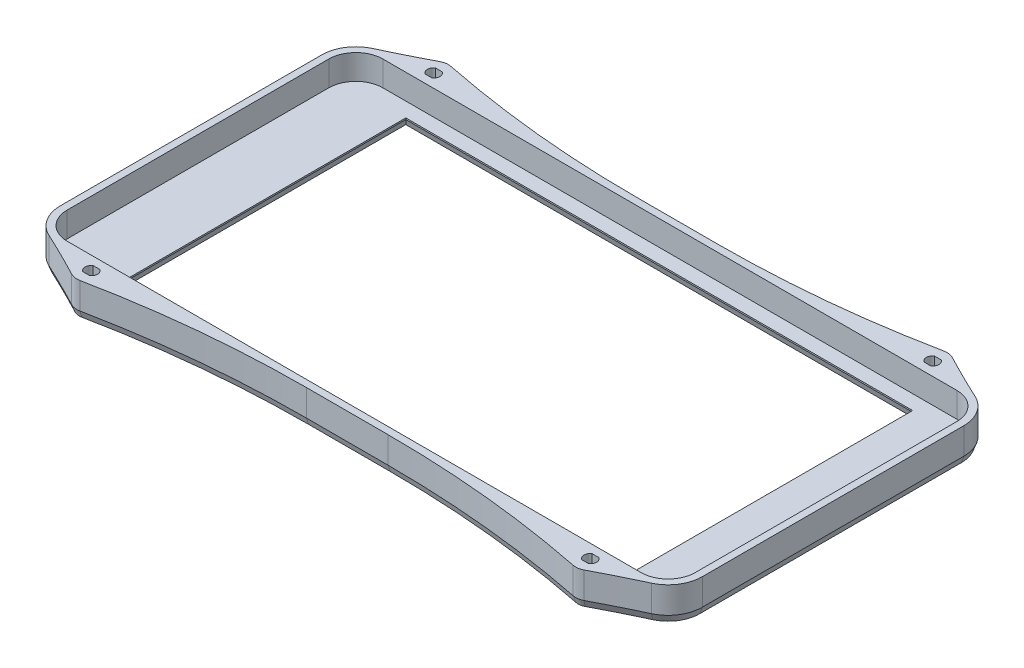
from build123d import *

# Parameters (mm, degrees)
EXTRUDE_1_DEPTH       = 2
EXTRUDE_2_DEPTH       = 8
SKETCH_6_R            = 3.5
SKETCH_6_R_2          = 1.5
EXTRUDE_10_DEPTH      = 8
SKETCH_7_W            = 121.7
SKETCH_7_H            = 68.8
CUT_EXTRUDE_1_DEPTH   = 10
FILLET_1_R            = 250
SKETCH_6_2_R          = 1.5
EXTRUDE_11_DEPTH      = 1.5
CHAMFER_1_SIZE        = 0.6
CHAMFER_1_SIZE2       = 1.648486452
CUT_EXTRUDE_START     = -6
CUT_EXTRUDE_1_2_DEPTH = 6
SKETCH_12_W           = 7.981613131
SKETCH_12_H           = 4.067552846
SKETCH_12_W_2         = 5
SKETCH_12_H_2         = 2.5
SKETCH_12_W_3         = 6.44213445
SKETCH_12_H_3         = 4.018836203
SKETCH_12_W_4         = 6.293487169
SKETCH_12_H_4         = 3.99394378
SKETCH_12_W_5         = 6.35997617
EXTRUDE_12_DEPTH      = 6.5


with BuildPart() as part:
    # 草图1 → 凸台-拉伸1 (new body)
    with BuildSketch(Plane(origin=(0, 0, 0), x_dir=(1, 0, 0), z_dir=(0, 1, 0))):
        with BuildLine():
            Line((6, 0.2), (143.8, 0.2))
            ThreePointArc((143.8, 0.2), (148.184062043, -1.615937957), (150, -6))
            Line((150, -6), (150, -68.8))
            ThreePointArc((150, -68.8), (148.184062043, -73.184062043), (143.8, -75))
            Line((143.8, -75), (6, -75))
            ThreePointArc((6, -75), (1.615937957, -73.184062043), (-0.2, -68.8))
            Line((-0.2, -68.8), (-0.2, -6))
            ThreePointArc((-0.2, -6), (1.615937957, -1.615937957), (6, 0.2))
        make_face()
    extrude(amount=EXTRUDE_1_DEPTH)

    # 草图1<5> → 拉伸-薄壁2 (add)
    with BuildSketch(Plane(origin=(0, 0, 0), x_dir=(1, 0, 0), z_dir=(0, 1, 0))):
        with BuildLine():
            Line((6, 2.2), (143.8, 2.2))
            ThreePointArc((143.8, 2.2), (149.598275606, -0.201724394), (152, -6))
            Line((152, -6), (152, -68.8))
            ThreePointArc((152, -68.8), (149.598275606, -74.598275606), (143.8, -77))
            Line((143.8, -77), (6, -77))
            ThreePointArc((6, -77), (0.201724394, -74.598275606), (-2.2, -68.8))
            Line((-2.2, -68.8), (-2.2, -6))
            ThreePointArc((-2.2, -6), (0.201724394, -0.201724394), (6, 2.2))
        make_face()
        with BuildLine():
            Line((6, 0.2), (143.8, 0.2))
            ThreePointArc((143.8, 0.2), (148.184062043, -1.615937957), (150, -6))
            Line((150, -6), (150, -68.8))
            ThreePointArc((150, -68.8), (148.184062043, -73.184062043), (143.8, -75))
            Line((143.8, -75), (6, -75))
            ThreePointArc((6, -75), (1.615937957, -73.184062043), (-0.2, -68.8))
            Line((-0.2, -68.8), (-0.2, -6))
            ThreePointArc((-0.2, -6), (1.615937957, -1.615937957), (6, 0.2))
        make_face(mode=Mode.SUBTRACT)
    extrude(amount=EXTRUDE_2_DEPTH)

    # 草图6 → 凸台-拉伸10 (add)
    # profile 1 of 4: a face of its own
    with BuildSketch(Plane(origin=(0, 0, 0), x_dir=(1, 0, 0), z_dir=(0, 1, 0))):
        with Locations((15, 3.7)):
            Circle(SKETCH_6_R)
        with Locations(Location((15, 3.7, 0), (0, 0, 90))):
            Circle(SKETCH_6_R_2, mode=Mode.SUBTRACT)
    # profile 2 of 4: a face of its own
    with BuildSketch(Plane(origin=(0, 0, 0), x_dir=(1, 0, 0), z_dir=(0, 1, 0))):
        with Locations((15, -78.5)):
            Circle(SKETCH_6_R)
        with Locations(Location((15, -78.5, 0), (0, 0, 90))):
            Circle(SKETCH_6_R_2, mode=Mode.SUBTRACT)
    # profile 3 of 4: a face of its own
    with BuildSketch(Plane(origin=(0, 0, 0), x_dir=(1, 0, 0), z_dir=(0, 1, 0))):
        with Locations((134.8, 3.7)):
            Circle(SKETCH_6_R)
        with Locations(Location((134.8, 3.7, 0), (0, 0, 90))):
            Circle(SKETCH_6_R_2, mode=Mode.SUBTRACT)
    # profile 4 of 4: a face of its own
    with BuildSketch(Plane(origin=(0, 0, 0), x_dir=(1, 0, 0), z_dir=(0, 1, 0))):
        with Locations((134.8, -78.5)):
            Circle(SKETCH_6_R)
        with Locations(Location((134.8, -78.5, 0), (0, 0, 90))):
            Circle(SKETCH_6_R_2, mode=Mode.SUBTRACT)
    extrude(amount=EXTRUDE_10_DEPTH)

    # 草图7 → Cut-Extrude 1 (cut)
    with BuildSketch(Plane(origin=(0, 0, 0), x_dir=(-1, 0, 0), z_dir=(0, -1, 0))):
        with Locations((-75.85, -37.4)):
            Rectangle(SKETCH_7_W, SKETCH_7_H)
    extrude(amount=-CUT_EXTRUDE_1_DEPTH, mode=Mode.SUBTRACT)

    # 圆角1
    fillet_1_edges = [part.edges().sort_by_distance(p)[0] for p in [
        (18.16227766, 4, 77),
        (11.83772234, 4, 77),
        (137.96227766, 4, 77),
        (131.63772234, 4, 77),
        (131.63772234, 4, -2.2),
        (137.96227766, 4, -2.2),
        (11.83772234, 4, -2.2),
        (18.16227766, 4, -2.2),
    ]]
    fillet(fillet_1_edges, radius=FILLET_1_R)

    # 草图6<2> → 凸台-拉伸11 (add)
    with BuildSketch(Plane(origin=(0, 0, 0), x_dir=(1, 0, 0), z_dir=(0, 1, 0))):
        with Locations(Location((15, 3.7, 0), (0, 0, 90))):
            Circle(SKETCH_6_2_R)
        with Locations(Location((15, -78.5, 0), (0, 0, 90))):
            Circle(SKETCH_6_2_R)
        with Locations(Location((134.8, 3.7, 0), (0, 0, 90))):
            Circle(SKETCH_6_2_R)
        with Locations(Location((134.8, -78.5, 0), (0, 0, 90))):
            Circle(SKETCH_6_2_R)
    extrude(amount=EXTRUDE_11_DEPTH)

    # 倒角1
    chamfer_1_edges = [part.edges().sort_by_distance(p)[0] for p in [
        (136.7, 0, 37.4),
        (75.85, 0, 71.8),
        (15, 0, 37.4),
        (75.85, 0, 3),
        (14.502874151, 0, 81.964515246),
        (74.9, 0, 77),
        (135.297125849, 0, 81.964515246),
        (150.714252509, 0, 73.20830038),
        (135.297125849, 0, -7.164515246),
        (74.9, 0, -2.2),
        (14.502874151, 0, -7.164515246),
        (-0.914252509, 0, 1.59169962),
        (7.988030543, 0, 78.850628869),
        (40.273083878, 0, 78.235796001),
        (141.811969457, 0, 78.850628869),
        (109.526916122, 0, 78.235796001),
        (141.811969457, 0, -4.050628869),
        (109.526916122, 0, -3.435796001),
        (7.988030543, 0, -4.050628869),
        (40.273083878, 0, -3.435796001),
        (-2.2, 0, 37.4),
        (-0.914252509, 0, 73.20830038),
        (152, 0, 37.4),
        (150.714252509, 0, 1.59169962),
    ]]
    chamfer_1_side = [part.faces().sort_by_distance(p)[0] for p in [
        (0.58783664, 0, 72.250617658),
    ]]
    chamfer(chamfer_1_edges, length=CHAMFER_1_SIZE, length2=CHAMFER_1_SIZE2, reference=chamfer_1_side[0])

    # 草图11 → Cut-Extrude 1 2 (cut)
    with BuildSketch(Plane(origin=(0, 8, 0), x_dir=(1, 0, 0), z_dir=(0, 1, 0)).offset(CUT_EXTRUDE_START)):
        with BuildLine():
            Line((143.8, 0.5), (6, 0.5))
            ThreePointArc((6, 0.5), (1.403805922, -1.403805922), (-0.5, -6))
            Line((-0.5, -6), (-0.5, -68.8))
            ThreePointArc((-0.5, -68.8), (1.403805922, -73.396194078), (6, -75.3))
            Line((6, -75.3), (143.8, -75.3))
            ThreePointArc((143.8, -75.3), (148.396194078, -73.396194078), (150.3, -68.8))
            Line((150.3, -68.8), (150.3, -6))
            ThreePointArc((150.3, -6), (148.396194078, -1.403805922), (143.8, 0.5))
        make_face()
        with BuildLine():
            Line((143.8, 0.2), (6, 0.2))
            ThreePointArc((6, 0.2), (1.615937957, -1.615937957), (-0.2, -6))
            Line((-0.2, -6), (-0.2, -68.8))
            ThreePointArc((-0.2, -68.8), (1.615937957, -73.184062043), (6, -75))
            Line((6, -75), (143.8, -75))
            ThreePointArc((143.8, -75), (148.184062043, -73.184062043), (150, -68.8))
            Line((150, -68.8), (150, -6))
            ThreePointArc((150, -6), (148.184062043, -1.615937957), (143.8, 0.2))
        make_face(mode=Mode.SUBTRACT)
    extrude(amount=CUT_EXTRUDE_1_2_DEPTH, mode=Mode.SUBTRACT)

    # 草图12 → 凸台-拉伸12 (add)
    # profile 1 of 4: a face of its own
    with BuildSketch(Plane(origin=(0, 8, 0), x_dir=(1, 0, 0), z_dir=(0, 1, 0))):
        with Locations((15.444728275, 3.558916951)):
            Rectangle(SKETCH_12_W, SKETCH_12_H)
        with Locations((15, 3.7)):
            Rectangle(SKETCH_12_W_2, SKETCH_12_H_2, mode=Mode.SUBTRACT)
    # profile 2 of 4: a face of its own
    with BuildSketch(Plane(origin=(0, 8, 0), x_dir=(1, 0, 0), z_dir=(0, 1, 0))):
        with Locations((134.555490907, 3.789730855)):
            Rectangle(SKETCH_12_W_3, SKETCH_12_H_3)
        with Locations((134.8, 3.7)):
            Rectangle(SKETCH_12_W_2, SKETCH_12_H_2, mode=Mode.SUBTRACT)
    # profile 3 of 4: a face of its own
    with BuildSketch(Plane(origin=(0, 8, 0), x_dir=(1, 0, 0), z_dir=(0, 1, 0))):
        with Locations((134.721799576, -78.476357082)):
            Rectangle(SKETCH_12_W_4, SKETCH_12_H_4)
        with Locations((134.8, -78.5)):
            Rectangle(SKETCH_12_W_2, SKETCH_12_H_2, mode=Mode.SUBTRACT)
    # profile 4 of 4: a face of its own
    with BuildSketch(Plane(origin=(0, 8, 0), x_dir=(1, 0, 0), z_dir=(0, 1, 0))):
        with Locations((15.237842113, -78.476357082)):
            Rectangle(SKETCH_12_W_5, SKETCH_12_H_4)
        with Locations((15, -78.5)):
            Rectangle(SKETCH_12_W_2, SKETCH_12_H_2, mode=Mode.SUBTRACT)
    extrude(amount=-EXTRUDE_12_DEPTH)


solid = part.part
